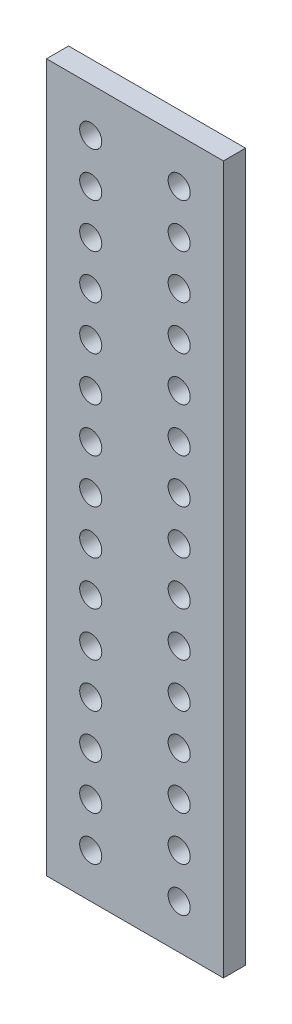
from build123d import *

# Parameters (mm, degrees)
SKETCH1_W           = 50.8
SKETCH1_H           = 203.2
SKETCH1_R           = 3.175
BOSS_EXTRUDE1_DEPTH = 6.35


with BuildPart() as part:
    # Sketch1 → Boss-Extrude1 (new body)
    with BuildSketch(Plane.XY):
        Rectangle(SKETCH1_W, SKETCH1_H)
        with Locations((-12.7, 88.9)):
            Circle(SKETCH1_R, mode=Mode.SUBTRACT)
        with Locations((12.7, 88.9)):
            Circle(SKETCH1_R, mode=Mode.SUBTRACT)
        with Locations((12.7, 76.2)):
            Circle(SKETCH1_R, mode=Mode.SUBTRACT)
        with Locations((12.7, 63.5)):
            Circle(SKETCH1_R, mode=Mode.SUBTRACT)
        with Locations((12.7, 50.8)):
            Circle(SKETCH1_R, mode=Mode.SUBTRACT)
        with Locations((12.7, 38.1)):
            Circle(SKETCH1_R, mode=Mode.SUBTRACT)
        with Locations((12.7, 25.4)):
            Circle(SKETCH1_R, mode=Mode.SUBTRACT)
        with Locations((12.7, 12.7)):
            Circle(SKETCH1_R, mode=Mode.SUBTRACT)
        with Locations((12.7, 0)):
            Circle(SKETCH1_R, mode=Mode.SUBTRACT)
        with Locations((12.7, -12.7)):
            Circle(SKETCH1_R, mode=Mode.SUBTRACT)
        with Locations((12.7, -25.4)):
            Circle(SKETCH1_R, mode=Mode.SUBTRACT)
        with Locations((12.7, -38.1)):
            Circle(SKETCH1_R, mode=Mode.SUBTRACT)
        with Locations((-12.7, -50.8)):
            Circle(SKETCH1_R, mode=Mode.SUBTRACT)
        with Locations((12.7, -50.8)):
            Circle(SKETCH1_R, mode=Mode.SUBTRACT)
        with Locations((-12.7, -63.5)):
            Circle(SKETCH1_R, mode=Mode.SUBTRACT)
        with Locations((12.7, -63.5)):
            Circle(SKETCH1_R, mode=Mode.SUBTRACT)
        with Locations((-12.7, -76.2)):
            Circle(SKETCH1_R, mode=Mode.SUBTRACT)
        with Locations((12.7, -76.2)):
            Circle(SKETCH1_R, mode=Mode.SUBTRACT)
        with Locations((-12.7, -88.9)):
            Circle(SKETCH1_R, mode=Mode.SUBTRACT)
        with Locations((12.7, -88.9)):
            Circle(SKETCH1_R, mode=Mode.SUBTRACT)
        with Locations((-12.7, 76.2)):
            Circle(SKETCH1_R, mode=Mode.SUBTRACT)
        with Locations((-12.7, 63.5)):
            Circle(SKETCH1_R, mode=Mode.SUBTRACT)
        with Locations((-12.7, 50.8)):
            Circle(SKETCH1_R, mode=Mode.SUBTRACT)
        with Locations((-12.7, 38.1)):
            Circle(SKETCH1_R, mode=Mode.SUBTRACT)
        with Locations((-12.7, 25.4)):
            Circle(SKETCH1_R, mode=Mode.SUBTRACT)
        with Locations((-12.7, 12.7)):
            Circle(SKETCH1_R, mode=Mode.SUBTRACT)
        with Locations((-12.7, 0)):
            Circle(SKETCH1_R, mode=Mode.SUBTRACT)
        with Locations((-12.7, -12.7)):
            Circle(SKETCH1_R, mode=Mode.SUBTRACT)
        with Locations((-12.7, -25.4)):
            Circle(SKETCH1_R, mode=Mode.SUBTRACT)
        with Locations((-12.7, -38.1)):
            Circle(SKETCH1_R, mode=Mode.SUBTRACT)
    extrude(amount=BOSS_EXTRUDE1_DEPTH)


solid = part.part
